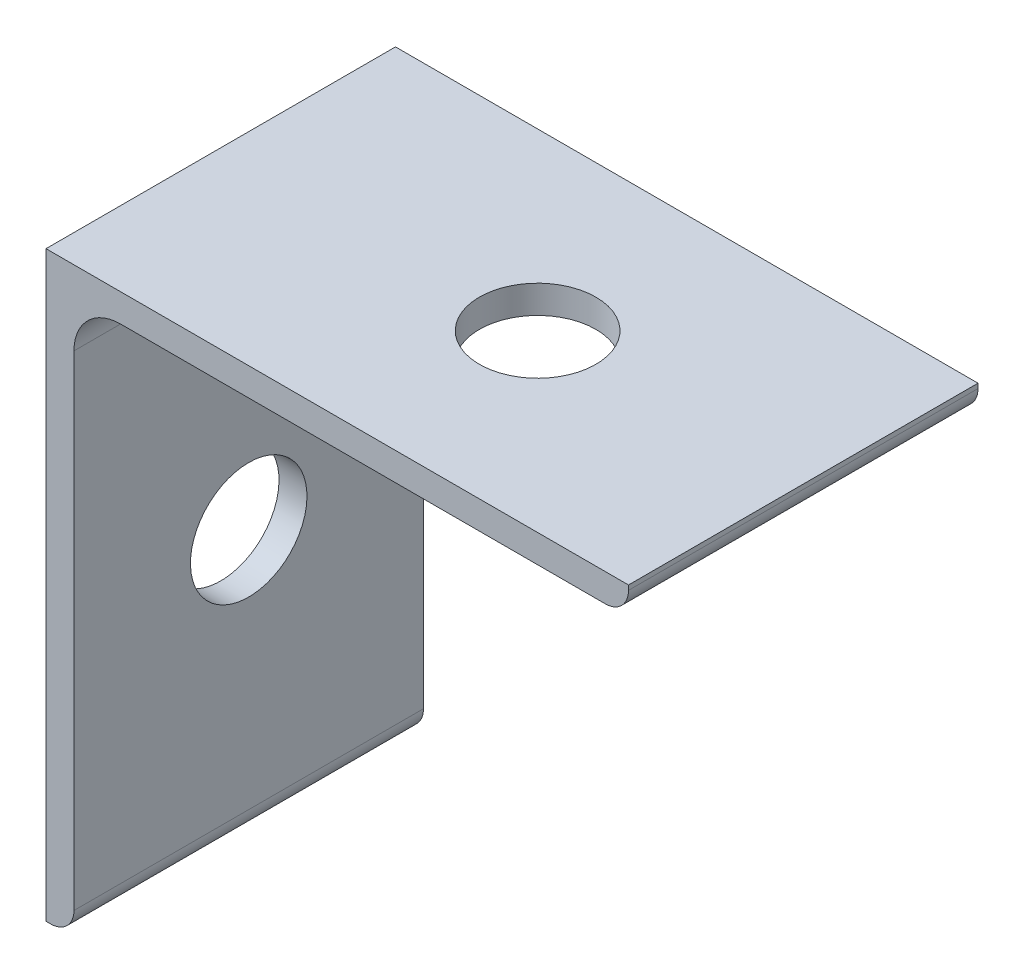
from build123d import *

# Parameters (mm, degrees)
RESSALTO_EXTRUS_O1_DEPTH = 15
ESBO_O2_R                = 2.5
CORTE_EXTRUS_O1_DEPTH    = 126.770027202
ESBO_O3_R                = 2.5
CORTE_EXTRUS_O2_DEPTH    = 35.768628391


with BuildPart() as part:
    # Esboço1 → Ressalto-extrusão1 (new body)
    with BuildSketch(Plane.XY):
        with BuildLine():
            Line((98.783276764, -3.569201676), (98.783276764, 17.230798324))
            ThreePointArc((98.783276764, 17.230798324), (99.369063202, 18.645011887), (100.783276764, 19.230798324))
            Line((100.783276764, 19.230798324), (121.583276764, 19.230798324))
            ThreePointArc((121.583276764, 19.230798324), (122.290383546, 19.523691543), (122.583276764, 20.230798324))
            Line((122.583276764, 20.230798324), (122.583276764, 20.430798324))
            Line((122.583276764, 20.430798324), (97.583276764, 20.430798324))
            Line((97.583276764, 20.430798324), (97.583276764, -4.569201676))
            Line((97.583276764, -4.569201676), (97.783276764, -4.569201676))
            ThreePointArc((97.783276764, -4.569201676), (98.490383546, -4.276308457), (98.783276764, -3.569201676))
        make_face()
    extrude(amount=RESSALTO_EXTRUS_O1_DEPTH)

    # Esboço2 → Corte-extrusão1 (cut, through all)
    with BuildSketch(Plane.XZ.offset(-19.230798324)):
        with Locations(Location((111.183276764, 7.5, 0), (0, 0, 270))):
            Circle(ESBO_O2_R)
    extrude(amount=-CORTE_EXTRUS_O1_DEPTH, mode=Mode.SUBTRACT)

    # Esboço3 → Corte-extrusão2 (cut, through all)
    with BuildSketch(Plane(origin=(98.783276764, 0, 0), x_dir=(0, 0, -1), z_dir=(1, 0, 0))):
        with Locations(Location((-7.5, 6.830798324, 0), (0, 0, 90))):
            Circle(ESBO_O3_R)
    extrude(amount=-CORTE_EXTRUS_O2_DEPTH, mode=Mode.SUBTRACT)


solid = part.part
